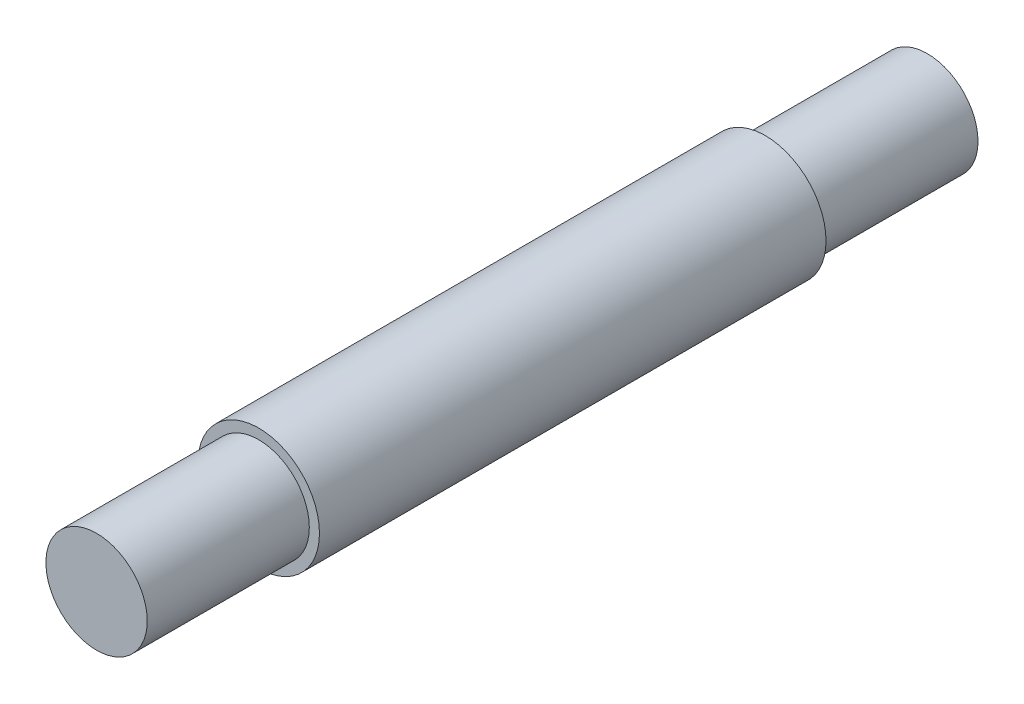
from build123d import *


with BuildPart() as part:
    # Çizim1 → Döndür2 (revolve)
    with BuildSketch(Plane(origin=(0, 0, 0), x_dir=(0, 0, -1), z_dir=(1, 0, 0)), mode=Mode.PRIVATE) as d_nd_r2_sk:
        Polygon((3.275449102, 16.616766467), (19.275449102, 16.616766467), (19.275449102, 11.616766467), (-62.724550898, 11.616766467), (-62.724550898, 16.616766467), (-46.724550898, 16.616766467), (-46.724550898, 17.616766467), (3.275449102, 17.616766467), align=None)
    revolve(d_nd_r2_sk.sketch.rotate(Axis((0, 11.616766467, 62.724550898), (0, 0, -1)), 90), axis=Axis((0, 11.616766467, 62.724550898), (0, 0, -1)))


solid = part.part
